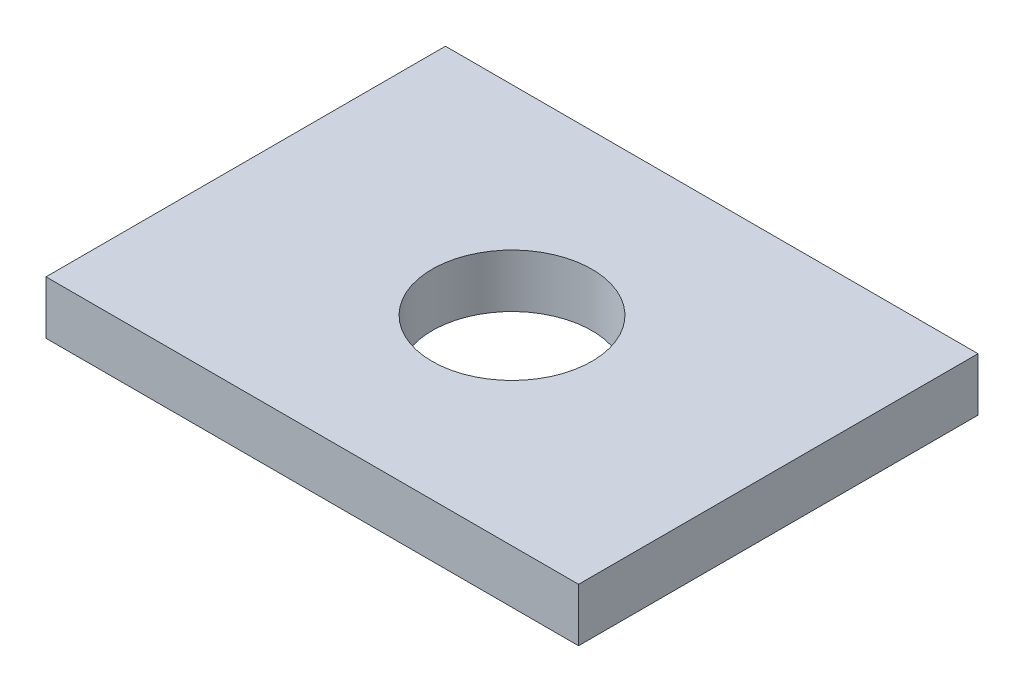
from build123d import *

# Parameters (mm, degrees)
SKETCH1_W           = 25.4
SKETCH1_H           = 19.05
BOSS_EXTRUDE1_DEPTH = 2.54
SKETCH2_R           = 3.81
CUT_EXTRUDE1_DEPTH  = 17.076915904


with BuildPart() as part:
    # Sketch1 → Boss-Extrude1 (new body)
    with BuildSketch(Plane(origin=(0, 0, 0), x_dir=(1, 0, 0), z_dir=(0, 1, 0))):
        Rectangle(SKETCH1_W, SKETCH1_H)
    extrude(amount=BOSS_EXTRUDE1_DEPTH)

    # Sketch2 → Cut-Extrude1 (cut, through all)
    with BuildSketch(Plane(origin=(0, 2.54, 0), x_dir=(1, 0, 0), z_dir=(0, 1, 0))):
        with Locations(Location((0, 0, 0), (0, 0, 270))):
            Circle(SKETCH2_R)
    extrude(amount=-CUT_EXTRUDE1_DEPTH, mode=Mode.SUBTRACT)


solid = part.part
